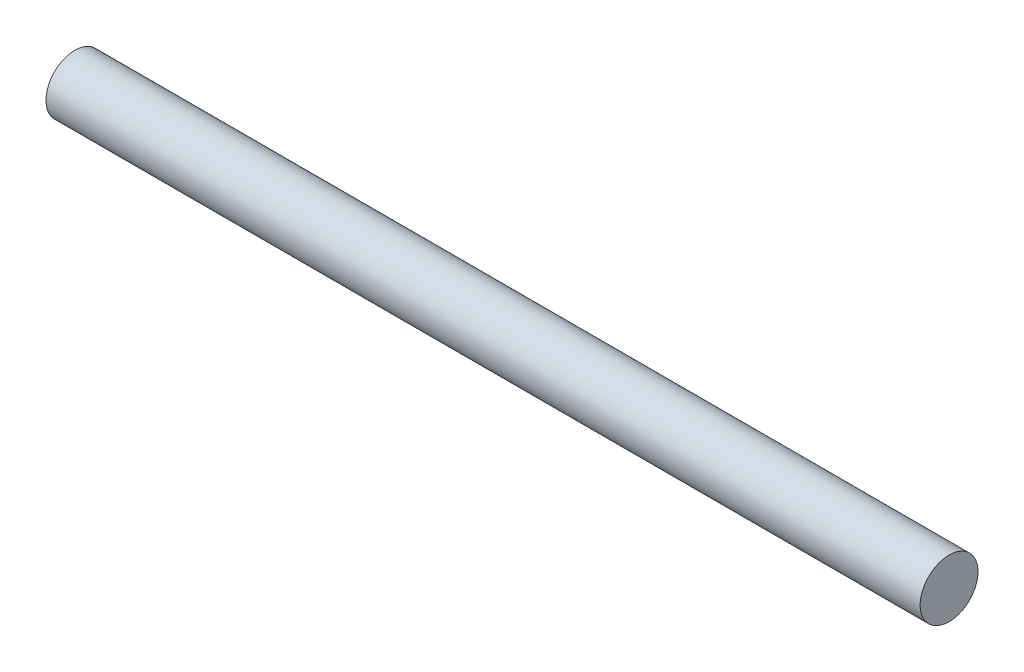
from build123d import *

# Parameters (mm, degrees)
SKETCH2_R           = 1.985
BOSS_EXTRUDE1_DEPTH = 60


with BuildPart() as part:
    # Sketch2 → Boss-Extrude1 (new body)
    with BuildSketch(Plane(origin=(0, 0, 0), x_dir=(0, 0, -1), z_dir=(1, 0, 0))):
        Circle(SKETCH2_R)
    extrude(amount=BOSS_EXTRUDE1_DEPTH)


solid = part.part
